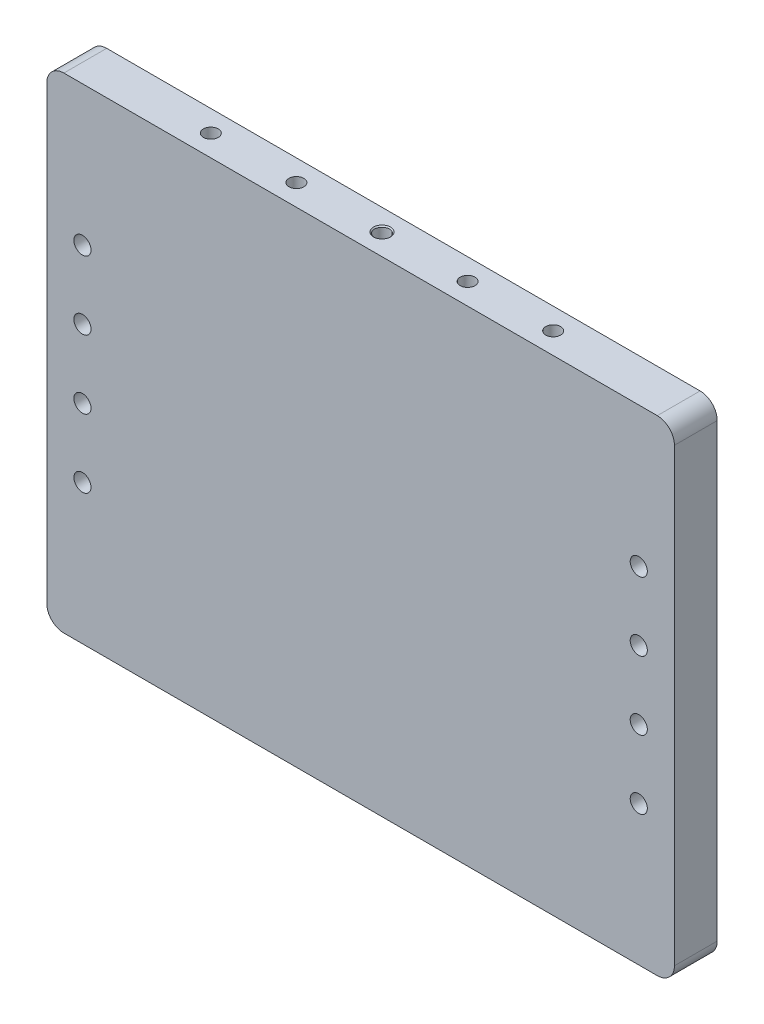
from build123d import *

# Parameters (mm, degrees)
SKETCH_1_R          = 1.5
EXTRUDE_1_DEPTH     = 7.5
SKETCH_2_R          = 1.3
CUT_EXTRUDE_1_DEPTH = 7.5
CUT_EXTRUDE_START   = -7.5
SKETCH_3_R          = 1.3
CUT_EXTRUDE_2_DEPTH = 7.5
CHAMFER_1_SIZE      = 0.2
CHAMFER_2_SIZE      = 0.2


with BuildPart() as part:
    # 草圖1 → 填料-伸長1 (new body)
    with BuildSketch(Plane.XY):
        with BuildLine():
            ThreePointArc((-55, -39.5), (-54.121320344, -41.621320344), (-52, -42.5))
            Line((-52, -42.5), (52, -42.5))
            ThreePointArc((52, -42.5), (54.121320344, -41.621320344), (55, -39.5))
            Line((55, -39.5), (55, 39.5))
            ThreePointArc((55, 39.5), (54.121320344, 41.621320344), (52, 42.5))
            Line((52, 42.5), (-52, 42.5))
            ThreePointArc((-52, 42.5), (-54.121320344, 41.621320344), (-55, 39.5))
            Line((-55, 39.5), (-55, -39.5))
        make_face()
        with Locations((-48.75, -18)):
            Circle(SKETCH_1_R, mode=Mode.SUBTRACT)
        with Locations((-48.75, -6)):
            Circle(SKETCH_1_R, mode=Mode.SUBTRACT)
        with Locations((48.75, -18)):
            Circle(SKETCH_1_R, mode=Mode.SUBTRACT)
        with Locations((48.75, -6)):
            Circle(SKETCH_1_R, mode=Mode.SUBTRACT)
        with Locations((-48.75, 6)):
            Circle(SKETCH_1_R, mode=Mode.SUBTRACT)
        with Locations((-48.75, 18)):
            Circle(SKETCH_1_R, mode=Mode.SUBTRACT)
        with Locations((48.75, 6)):
            Circle(SKETCH_1_R, mode=Mode.SUBTRACT)
        with Locations((48.75, 18)):
            Circle(SKETCH_1_R, mode=Mode.SUBTRACT)
    extrude(amount=EXTRUDE_1_DEPTH)

    # 草圖2 → 除料-伸長1 (cut)
    with BuildSketch(Plane(origin=(0, 42.5, 0), x_dir=(1, 0, 0), z_dir=(0, 1, 0))):
        with Locations((-15, -3.75)):
            Circle(SKETCH_2_R)
        with Locations((30, -3.75)):
            Circle(SKETCH_2_R)
        with Locations((0, -3.75)):
            Circle(SKETCH_2_R)
        with Locations((15, -3.75)):
            Circle(SKETCH_2_R)
        with Locations((-30, -3.75)):
            Circle(SKETCH_2_R)
    extrude(amount=-CUT_EXTRUDE_1_DEPTH, mode=Mode.SUBTRACT)

    # 草圖3 → 除料-伸長2 (cut)
    with BuildSketch(Plane(origin=(0, -42.5, 0), x_dir=(-1, 0, 0), z_dir=(0, -1, 0)).offset(CUT_EXTRUDE_START)):
        with Locations((15, -3.75)):
            Circle(SKETCH_3_R)
        with Locations((-30, -3.75)):
            Circle(SKETCH_3_R)
        with Locations((-15, -3.75)):
            Circle(SKETCH_3_R)
        with Locations((0, -3.75)):
            Circle(SKETCH_3_R)
        with Locations((30, -3.75)):
            Circle(SKETCH_3_R)
    extrude(amount=CUT_EXTRUDE_2_DEPTH, mode=Mode.SUBTRACT)

    # 導角1
    chamfer_1_edges = [part.edges().sort_by_distance(p)[0] for p in [
        (-31.3, 35, 3.75),
        (28.7, 35, 3.75),
        (13.7, 35, 3.75),
        (-1.3, 42.5, 3.75),
        (-16.3, 35, 3.75),
    ]]
    chamfer(chamfer_1_edges, length=CHAMFER_1_SIZE)

    # 導角2
    chamfer_2_edges = [part.edges().sort_by_distance(p)[0] for p in [
        (31.3, -42.5, 3.75),
        (16.3, -42.5, 3.75),
        (1.3, -42.5, 3.75),
        (-13.7, -42.5, 3.75),
        (-28.7, -42.5, 3.75),
    ]]
    chamfer(chamfer_2_edges, length=CHAMFER_2_SIZE)


solid = part.part
